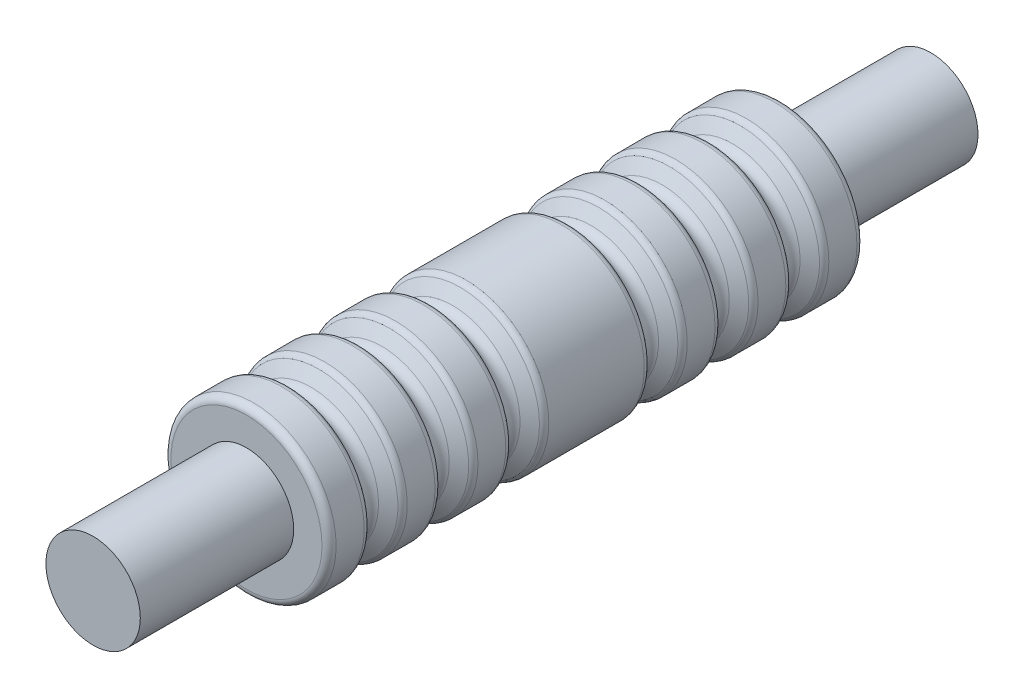
from build123d import *

# Parameters (mm, degrees)
SKETCH_1_R      = 2
EXTRUDE_1_DEPTH = 35.5
SKETCH_2_R      = 3.5
EXTRUDE_2_DEPTH = 22.67
FILLET_1_R      = 0.3
FILLET_2_R      = 0.3


with BuildPart() as part:
    # Эскиз1 → Вытянуть1 (new body)
    with BuildSketch(Plane.XY):
        Circle(SKETCH_1_R)
    extrude(amount=-EXTRUDE_1_DEPTH)

    # Эскиз2 → Вытянуть2 (add)
    with BuildSketch(Plane.XY.offset(-6.5)):
        Circle(SKETCH_2_R)
    extrude(amount=-EXTRUDE_2_DEPTH)

    # Эскиз3 → Вырез-Повернуть1 (revolve, cut)
    with BuildSketch(Plane(origin=(0, 0, 0), x_dir=(0, 0, -1), z_dir=(1, 0, 0)), mode=Mode.PRIVATE) as cut_revolve_1_sk:
        with BuildLine():
            Line((12.672475085, 3.543093373), (12.238612952, 2.853777405))
            ThreePointArc((12.238612952, 2.853777405), (11.900086245, 2.666849386), (11.561559539, 2.853777405))
            Line((11.561559539, 2.853777405), (11.127697406, 3.543093373))
            Line((11.127697406, 3.543093373), (12.672475085, 3.543093373))
        make_face()
        with BuildLine():
            Line((9.672475085, 3.543093373), (8.127697406, 3.543093373))
            Line((8.127697406, 3.543093373), (8.561559539, 2.853777405))
            ThreePointArc((8.561559539, 2.853777405), (8.900086245, 2.666849386), (9.238612952, 2.853777405))
            Line((9.238612952, 2.853777405), (9.672475085, 3.543093373))
        make_face()
        with BuildLine():
            Line((15.645351699, 3.5), (15.238612952, 2.853777405))
            ThreePointArc((15.238612952, 2.853777405), (14.900086245, 2.666849386), (14.561559539, 2.853777405))
            Line((14.561559539, 2.853777405), (14.154820792, 3.5))
            Line((14.154820792, 3.5), (15.645351699, 3.5))
        make_face()
        with BuildLine():
            Line((21.512909488, 3.5), (21.106170741, 2.853777405))
            ThreePointArc((21.106170741, 2.853777405), (20.767644034, 2.666849386), (20.429117328, 2.853777405))
            Line((20.429117328, 2.853777405), (20.02237858, 3.5))
            Line((20.02237858, 3.5), (21.512909488, 3.5))
        make_face()
        with BuildLine():
            Line((22.995255195, 3.543093373), (23.429117328, 2.853777405))
            ThreePointArc((23.429117328, 2.853777405), (23.767644034, 2.666849386), (24.106170741, 2.853777405))
            Line((24.106170741, 2.853777405), (24.540032874, 3.543093373))
            Line((24.540032874, 3.543093373), (22.995255195, 3.543093373))
        make_face()
        with BuildLine():
            Line((27.540032874, 3.543093373), (27.106170741, 2.853777405))
            ThreePointArc((27.106170741, 2.853777405), (26.767644034, 2.666849386), (26.429117328, 2.853777405))
            Line((26.429117328, 2.853777405), (25.995255195, 3.543093373))
            Line((25.995255195, 3.543093373), (27.540032874, 3.543093373))
        make_face()
    revolve(cut_revolve_1_sk.sketch.rotate(Axis((0, 0, -6.5), (0, 0, 1)), 270), axis=Axis((0, 0, -6.5), (0, 0, 1)), mode=Mode.SUBTRACT)

    # Скругление1
    fillet_1_edges = [part.edges().sort_by_distance(p)[0] for p in [
        (-3.5, 0, -11.154820792),
        (-3.5, 0, -12.645351699),
        (-3.5, 0, -8.154820792),
        (-3.5, 0, -9.645351699),
        (-3.5, 0, -20.02237858),
        (-3.5, 0, -21.512909488),
        (-3.5, 0, -14.154820792),
        (-3.5, 0, -15.645351699),
        (-3.5, 0, -24.512909488),
        (-3.5, 0, -23.02237858),
        (-3.5, 0, -26.02237858),
        (-3.5, 0, -27.512909488),
    ]]
    fillet(fillet_1_edges, radius=FILLET_1_R)

    # Скругление2
    fillet_2_edges = [part.edges().sort_by_distance(p)[0] for p in [
        (-3.5, 0, -29.17),
        (-3.5, 0, -6.5),
    ]]
    fillet(fillet_2_edges, radius=FILLET_2_R)


solid = part.part
